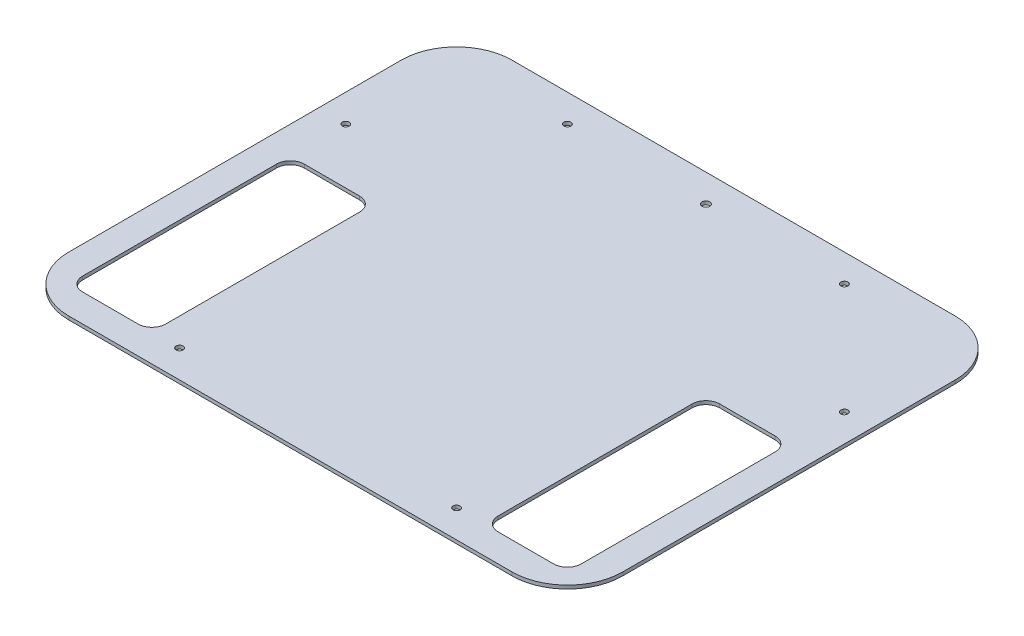
from build123d import *

# Parameters (mm, degrees)
SKETCH1_W                       = 508
SKETCH1_H                       = 406.4
EXTRUDE1_DEPTH                  = 3.175
SKETCH2_W                       = 76.2
SKETCH2_H                       = 203.2
EXTRUDE2_DEPTH                  = 326.294206258
FILLET2_R                       = 50.8
FILLET3_R                       = 12.7
F_1_4_0_25_DIAMETER_HOLE1_D     = 6.35
F_1_4_0_25_DIAMETER_HOLE1_DEPTH = 25.4
F_1_4_0_25_DIAMETER_HOLE1_TIP   = 1.907732465
CUT_EXTRUDE1_REACH              = 327.294
SKETCH5_R                       = 3.57844787


with BuildPart() as part:
    # Sketch1 → Extrude1 (new body)
    with BuildSketch(Plane(origin=(0, 0, 0), x_dir=(1, 0, 0), z_dir=(0, 1, 0))):
        Rectangle(SKETCH1_W, SKETCH1_H)
    extrude(amount=EXTRUDE1_DEPTH)

    # Sketch2 → Extrude2 (cut, through all)
    with BuildSketch(Plane(origin=(0, 3.175, 0), x_dir=(1, 0, 0), z_dir=(0, 1, 0))):
        with Locations((-190.5, -76.2)):
            Rectangle(SKETCH2_W, SKETCH2_H)
        with Locations((190.5, -76.2)):
            Rectangle(SKETCH2_W, SKETCH2_H)
    extrude(amount=-EXTRUDE2_DEPTH, mode=Mode.SUBTRACT)

    # Fillet2
    fillet2_edges = [part.edges().sort_by_distance(p)[0] for p in [
        (-254, 1.5875, -203.2),
        (254, 1.5875, -203.2),
        (254, 1.5875, 203.2),
        (-254, 1.5875, 203.2),
    ]]
    fillet(fillet2_edges, radius=FILLET2_R)

    # Fillet3
    fillet3_edges = [part.edges().sort_by_distance(p)[0] for p in [
        (-228.6, 1.5875, 177.8),
        (-228.6, 1.5875, -25.4),
        (-152.4, 1.5875, -25.4),
        (-152.4, 1.5875, 177.8),
        (152.4, 1.5875, 177.8),
        (152.4, 1.5875, -25.4),
        (228.6, 1.5875, -25.4),
        (228.6, 1.5875, 177.8),
    ]]
    fillet(fillet3_edges, radius=FILLET3_R)

    # 1/4 (0.25) Diameter Hole1
    with Locations(Plane(origin=(0, 3.175, 0), x_dir=(-1, 0, 0), z_dir=(0, 1, 0))):
        with Locations((127, -177.8), (-127, -177.8), (-228.6, -76.2), (228.6, -76.2), (127, 177.8), (-127, 177.8)):
            Hole(F_1_4_0_25_DIAMETER_HOLE1_D / 2, depth=F_1_4_0_25_DIAMETER_HOLE1_DEPTH)
            with Locations((0, 0, -(F_1_4_0_25_DIAMETER_HOLE1_DEPTH + F_1_4_0_25_DIAMETER_HOLE1_TIP / 2))):  # 118° drill point
                Cone(0, F_1_4_0_25_DIAMETER_HOLE1_D / 2, F_1_4_0_25_DIAMETER_HOLE1_TIP, mode=Mode.SUBTRACT)

    # Sketch5 → Cut-Extrude1 (cut, up to next)
    with BuildSketch(Plane(origin=(0, 3.175, 0), x_dir=(1, 0, 0), z_dir=(0, 1, 0)), mode=Mode.PRIVATE) as cut_extrude1_sk1:
        with Locations(Location((0, 177.8, 0), (0, 0, 270))):
            Circle(SKETCH5_R)
    cut_extrude1_tool1 = extrude(cut_extrude1_sk1.sketch, amount=-CUT_EXTRUDE1_REACH, mode=Mode.PRIVATE) & part.part
    add(cut_extrude1_tool1.solids().sort_by_distance((0, 3.175, -177.8))[0], mode=Mode.SUBTRACT)


solid = part.part
